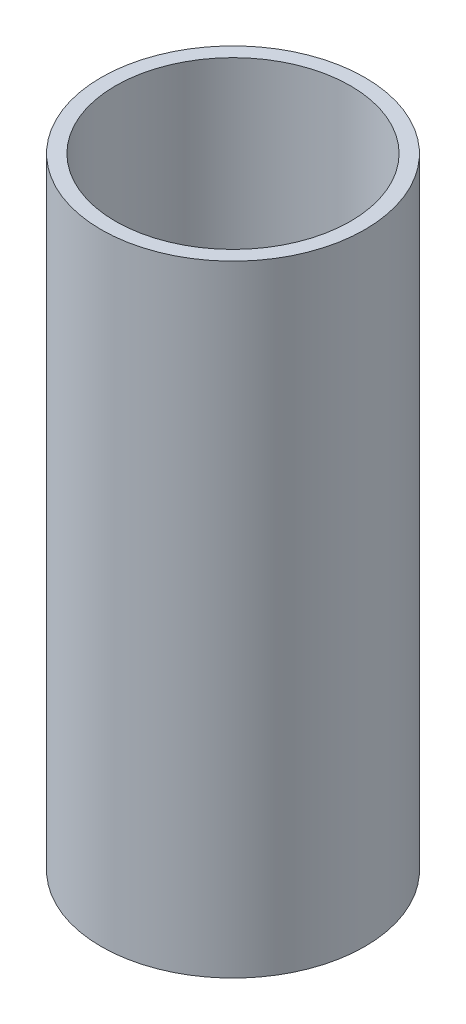
from build123d import *

# Parameters (mm, degrees)
SKETCH1_R           = 11
SKETCH1_R_2         = 9.8
BOSS_EXTRUDE1_DEPTH = 51.8


with BuildPart() as part:
    # Sketch1 → Boss-Extrude1 (new body)
    with BuildSketch(Plane(origin=(0, 0, 0), x_dir=(1, 0, 0), z_dir=(0, 1, 0))):
        with Locations(Location((0, 0, 0), (0, 0, 90))):
            Circle(SKETCH1_R)
        with Locations(Location((0, 0, 0), (0, 0, 90))):
            Circle(SKETCH1_R_2, mode=Mode.SUBTRACT)
    extrude(amount=BOSS_EXTRUDE1_DEPTH)


solid = part.part
